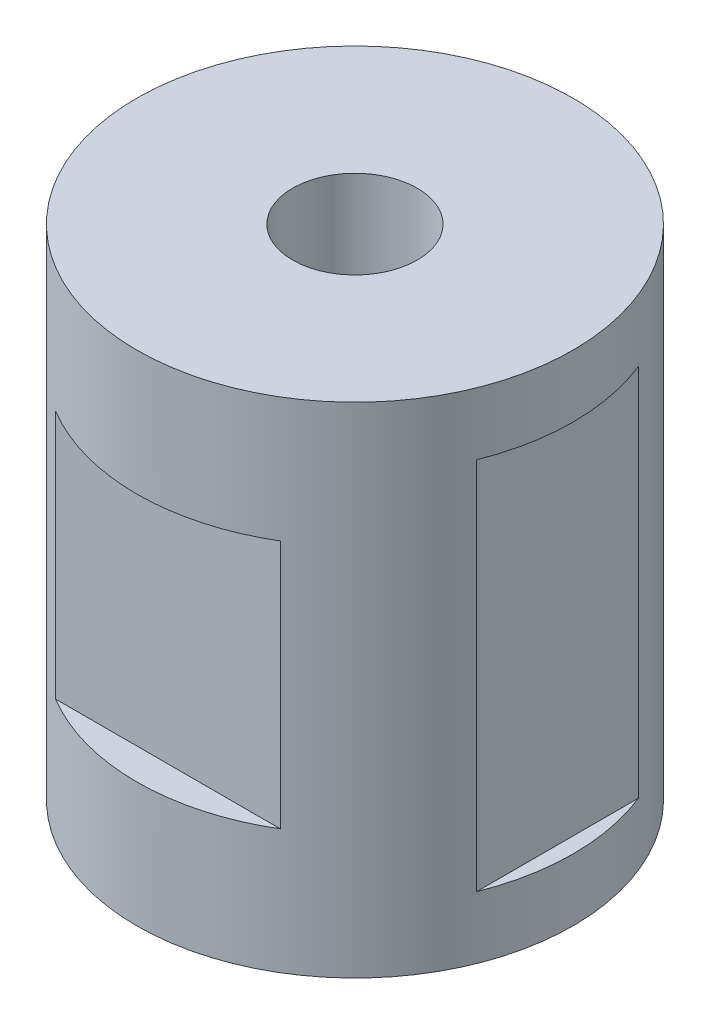
from build123d import *

# Parameters (mm, degrees)
SKETCH1_R           = 35
SKETCH1_R_2         = 10
BOSS_EXTRUDE1_DEPTH = 80
SKETCH2_W           = 25.98
SKETCH2_H           = 60
CUT_EXTRUDE1_DEPTH  = 2.5
SKETCH3_W           = 36.06
SKETCH3_H           = 40
CUT_EXTRUDE2_DEPTH  = 5


with BuildPart() as part:
    # Sketch1 → Boss-Extrude1 (new body)
    with BuildSketch(Plane(origin=(0, 0, 0), x_dir=(1, 0, 0), z_dir=(0, 1, 0))):
        with Locations(Location((0, 0, 0), (0, 0, 270))):
            Circle(SKETCH1_R)
        with Locations(Location((0, 0, 0), (0, 0, 270))):
            Circle(SKETCH1_R_2, mode=Mode.SUBTRACT)
    extrude(amount=BOSS_EXTRUDE1_DEPTH)

    # Sketch2 → Cut-Extrude1 (cut)
    with BuildSketch(Plane(origin=(35, 0, 0), x_dir=(0, 0, -1), z_dir=(1, 0, 0))):
        with Locations((0, 40)):
            Rectangle(SKETCH2_W, SKETCH2_H)
    extrude(amount=-CUT_EXTRUDE1_DEPTH, mode=Mode.SUBTRACT)

    # Sketch3 → Cut-Extrude2 (cut)
    with BuildSketch(Plane.XY.offset(35)):
        with Locations((0, 40)):
            Rectangle(SKETCH3_W, SKETCH3_H)
    extrude(amount=-CUT_EXTRUDE2_DEPTH, mode=Mode.SUBTRACT)


solid = part.part
